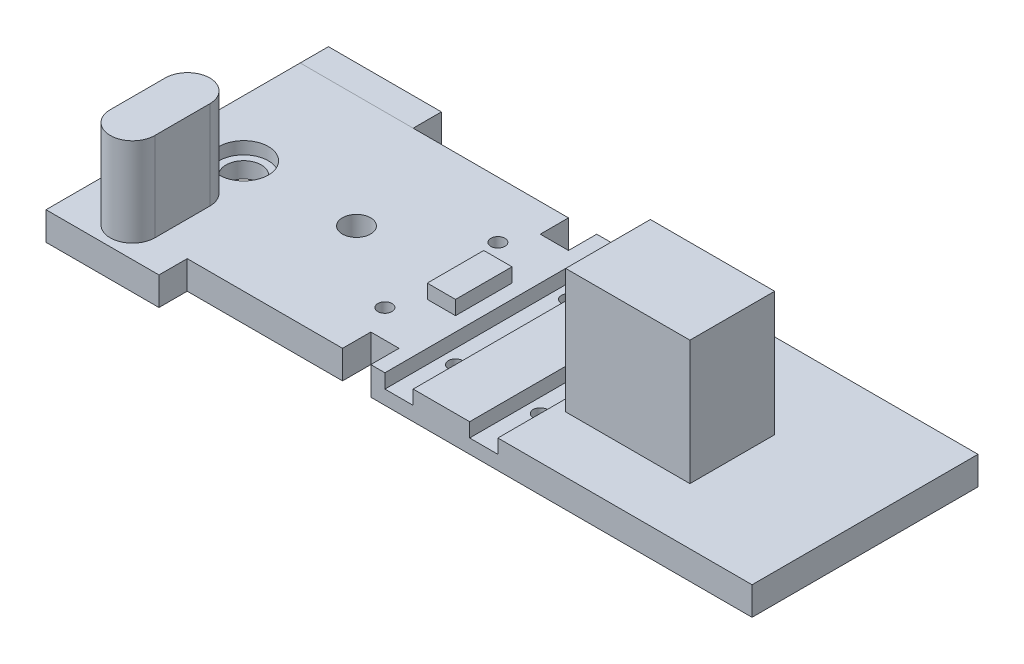
from build123d import *

# Parameters (mm, degrees)
SKETCH1_W             = 304.8
SKETCH1_H             = 101.6
BOSS_EXTRUDE1_DEPTH   = 12.7
SKETCH3_R             = 11.1125
CUT_EXTRUDE2_DEPTH    = 5.55625
SKETCH9_W             = 12.7
SKETCH9_H             = 6.35
CUT_EXTRUDE5_DEPTH    = 322.53831809
CUT_EXTRUDE8_START    = 6.35
SKETCH15_R            = 3.175
CUT_EXTRUDE8_DEPTH    = 25.4
SKETCH17_W            = 55.88
SKETCH17_H            = 38.1
BOSS_EXTRUDE5_DEPTH   = 55.88
SKETCH20_W            = 12.7
SKETCH20_H            = 12.7
BOSS_EXTRUDE7_DEPTH   = 50.8
BOSS_EXTRUDE7_2_DEPTH = 50.8
SKETCH21_R            = 7.9375
CUT_EXTRUDE10_DEPTH   = 332.273214755
BOSS_EXTRUDE8_DEPTH   = 39.878
SKETCH23_R            = 6.35
CUT_EXTRUDE11_DEPTH   = 331.287911374
SKETCH24_W            = 12.7
SKETCH24_H            = 25.4
BOSS_EXTRUDE9_DEPTH   = 6.35
SKETCH25_W            = 12.7
SKETCH25_H            = 12.7
CUT_EXTRUDE12_DEPTH   = 331.287911374


with BuildPart() as part:
    # Sketch1 → Boss-Extrude1 (new body)
    with BuildSketch(Plane(origin=(0, 0, 0), x_dir=(1, 0, 0), z_dir=(0, 1, 0))):
        with Locations((152.4, 50.8)):
            Rectangle(SKETCH1_W, SKETCH1_H)
    extrude(amount=BOSS_EXTRUDE1_DEPTH)

    # Sketch3 → Cut-Extrude2 (cut)
    with BuildSketch(Plane(origin=(0, 12.7, 0), x_dir=(1, 0, 0), z_dir=(0, 1, 0))):
        with Locations(Location((25.4, 50.8, 0), (0, 0, 270))):
            Circle(SKETCH3_R)
    extrude(amount=-CUT_EXTRUDE2_DEPTH, mode=Mode.SUBTRACT)

    # Sketch9 → Cut-Extrude5 (cut, through all)
    with BuildSketch(Plane.XY):
        with Locations((146.05, 9.525)):
            Rectangle(SKETCH9_W, SKETCH9_H)
        with Locations((184.15, 9.525)):
            Rectangle(SKETCH9_W, SKETCH9_H)
    extrude(amount=-CUT_EXTRUDE5_DEPTH, mode=Mode.SUBTRACT)

    # Sketch15 → Cut-Extrude8 (cut)
    with BuildSketch(Plane(origin=(0, 6.35, 0), x_dir=(1, 0, 0), z_dir=(0, 1, 0)).offset(CUT_EXTRUDE8_START)):
        with Locations((146.05, 25.4)):
            Circle(SKETCH15_R)
        with Locations(Location((184.15, 76.2, 0), (0, 0, 270))):
            Circle(SKETCH15_R)
        with Locations(Location((184.15, 25.4, 0), (0, 0, 270))):
            Circle(SKETCH15_R)
        with Locations((146.05, 76.2)):
            Circle(SKETCH15_R)
        with Locations(Location((114.3, 25.4, 0), (0, 0, 90))):
            Circle(SKETCH15_R)
        with Locations(Location((114.3, 76.2, 0), (0, 0, 90))):
            Circle(SKETCH15_R)
    extrude(amount=-CUT_EXTRUDE8_DEPTH, mode=Mode.SUBTRACT)

    # Sketch17 → Boss-Extrude5 (add)
    with BuildSketch(Plane(origin=(0, 12.7, 0), x_dir=(1, 0, 0), z_dir=(0, 1, 0))):
        with Locations((223.52, 44.45)):
            Rectangle(SKETCH17_W, SKETCH17_H)
    extrude(amount=BOSS_EXTRUDE5_DEPTH)

    # Sketch21 → Cut-Extrude10 (cut, through all)
    with BuildSketch(Plane(origin=(0, 7.14375, 0), x_dir=(1, 0, 0), z_dir=(0, 1, 0))):
        with Locations(Location((25.4, 50.8, 0), (0, 0, 270))):
            Circle(SKETCH21_R)
    extrude(amount=-CUT_EXTRUDE10_DEPTH, mode=Mode.SUBTRACT)



with BuildPart() as body_2:
    # Sketch20 → Boss-Extrude7 (new body)
    with BuildSketch(Plane.ZY):
        with Locations((6.35, 6.35)):
            Rectangle(SKETCH20_W, SKETCH20_H)
    extrude(amount=-BOSS_EXTRUDE7_DEPTH)


with BuildPart() as body_3:
    # Sketch20 → Boss-Extrude7 2 (new body)
    with BuildSketch(Plane.ZY):
        with Locations((-107.95, 6.35)):
            Rectangle(SKETCH20_W, SKETCH20_H)
    extrude(amount=-BOSS_EXTRUDE7_2_DEPTH)


with BuildPart() as part_1:
    add(part.part)

    add(body_2.part)  # Boss-Extrude8 merges body 2
    # Sketch22 → Boss-Extrude8 (add)
    with BuildSketch(Plane(origin=(0, 12.7, 0), x_dir=(1, 0, 0), z_dir=(0, 1, 0))):
        with BuildLine():
            Line((35.433, 25.527), (35.433, 0.807734429))
            ThreePointArc((35.433, 0.807734429), (25.4, -9.225265571), (15.367, 0.807734429))
            Line((15.367, 0.807734429), (15.367, 25.527))
            ThreePointArc((15.367, 25.527), (25.4, 35.56), (35.433, 25.527))
        make_face()
    extrude(amount=BOSS_EXTRUDE8_DEPTH)

    # Sketch23 → Cut-Extrude11 (cut, through all)
    with BuildSketch(Plane(origin=(0, 12.7, 0), x_dir=(1, 0, 0), z_dir=(0, 1, 0))):
        with Locations(Location((76.117084071, 50.8, 0), (0, 0, 270))):
            Circle(SKETCH23_R)
    extrude(amount=-CUT_EXTRUDE11_DEPTH, mode=Mode.SUBTRACT)

    # Sketch24 → Boss-Extrude9 (add)
    with BuildSketch(Plane(origin=(0, 12.7, 0), x_dir=(1, 0, 0), z_dir=(0, 1, 0))):
        with Locations((127, 50.8)):
            Rectangle(SKETCH24_W, SKETCH24_H)
    extrude(amount=BOSS_EXTRUDE9_DEPTH)

    # Sketch25 → Cut-Extrude12 (cut, through all)
    with BuildSketch(Plane(origin=(0, 12.7, 0), x_dir=(1, 0, 0), z_dir=(0, 1, 0))):
        with Locations((127, 95.25)):
            Rectangle(SKETCH25_W, SKETCH25_H)
        with Locations((127, 6.35)):
            Rectangle(SKETCH25_W, SKETCH25_H)
    extrude(amount=-CUT_EXTRUDE12_DEPTH, mode=Mode.SUBTRACT)


solid = Compound([body_3.part, part_1.part])
